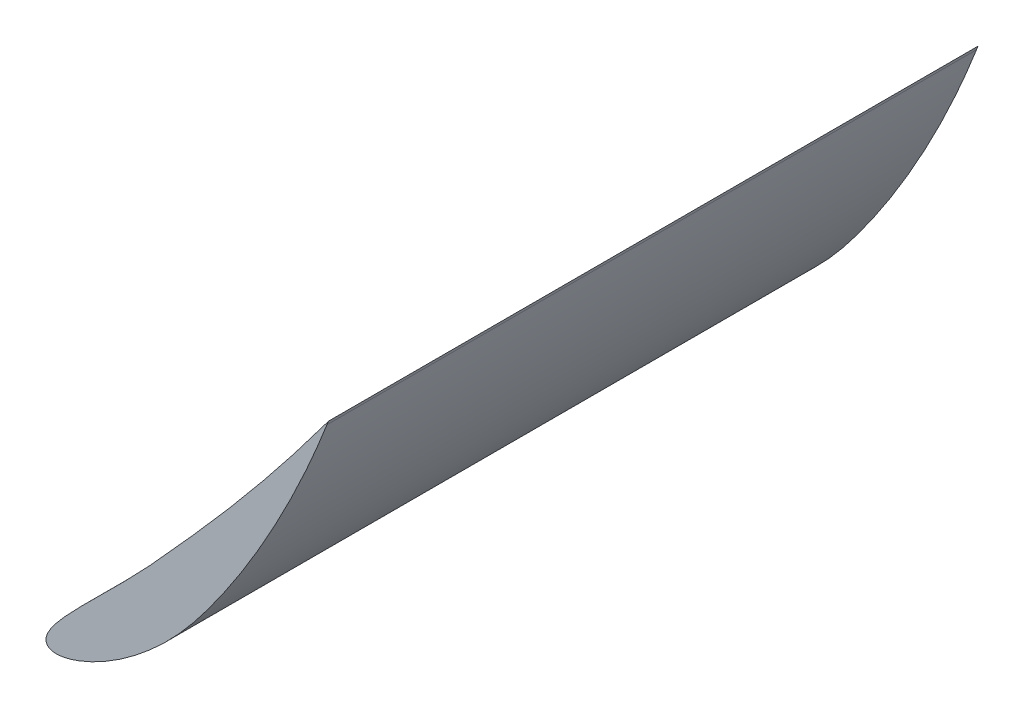
from build123d import *

# Parameters (mm, degrees)
BOSS_EXTRUDE1_DEPTH = 228.6


with BuildPart() as part:
    # Sketch1 → Boss-Extrude1 (new body)
    with BuildSketch(Plane.XY):
        with BuildLine():
            Line((97.813733214, 116.868603431), (98.631287897, 117.970297864))
            Line((98.631287897, 117.970297864), (98.107930219, 116.621742832))
            add(Edge.make_bspline(
                [(98.107930219, 116.621742832), (98.07801504, 116.544659288), (97.958558513, 116.236851248), (97.689273802, 115.547006234), (97.240037934, 114.404059771), (96.609003613, 112.818724882), (95.794855225, 110.805135637), (94.795820224, 108.38138303), (93.610319053, 105.568768694), (92.237197618, 102.391824455), (90.675809542, 98.877661272), (88.925940701, 95.056088102), (86.98938393, 90.958371877), (84.868121504, 86.617956454), (82.565559006, 82.069626079), (80.087304421, 77.348824446), (77.439505968, 72.492152356), (74.630452673, 67.536440727), (71.669301571, 62.518881178), (68.566940922, 57.476719864), (65.336524815, 52.4460022), (61.991116763, 47.463414346), (58.547239856, 42.563147076), (55.018907809, 37.781638104), (51.436484036, 33.141179764), (47.734989115, 28.738803302), (43.94718041, 24.598051047), (40.101909176, 20.739713361), (36.231846694, 17.180383406), (32.372054377, 13.932580409), (28.55919633, 11.005685778), (24.831811775, 8.404852292), (21.228534655, 6.132931801), (17.78843142, 4.189190577), (14.549557874, 2.570815951), (11.547836298, 1.27357543), (8.816936286, 0.290663381), (6.385798662, -0.384068928), (4.278148337, -0.759421479), (2.507945652, -0.841091713), (1.075856946, -0.630099094), (-0.016081371, -0.098164963), (-0.694809938, 0.792786704), (-0.826333116, 1.958474324), (-0.495963942, 3.291459945), (0.236182589, 4.834249535), (1.365544939, 6.603747658), (2.880735226, 8.604450584), (4.766161485, 10.834891684), (7.000774329, 13.291518365), (9.559743009, 15.96973743), (12.41365281, 18.865099168), (15.53128733, 21.971532577), (18.877704366, 25.283416008), (22.416727847, 28.79351034), (26.110153606, 32.494080901), (29.919561066, 36.375547799), (33.805981413, 40.426973128), (37.732446576, 44.634743282), (41.658159817, 48.987486858), (45.632259151, 53.393089395), (49.613105115, 57.841187968), (53.574221912, 62.305859138), (57.485854698, 66.764142947), (61.321955514, 71.190023639), (65.057320193, 75.557697094), (68.668804722, 79.840130915), (72.135956402, 84.009508776), (75.439083539, 88.038628097), (78.561652728, 91.899450431), (81.487941908, 95.565167313), (84.204374052, 99.009452971), (86.698170757, 102.207726841), (88.959042546, 105.136108909), (90.976778641, 107.773302857), (92.7432067, 110.09961291), (94.250420258, 112.098040239), (95.492454297, 113.753595868), (96.46399614, 115.054026865), (97.160788813, 115.989952744), (97.580313003, 116.554058419), (97.766999218, 116.805627114), (97.813733214, 116.868603431)],
                knots=[0, 0, 0, 0, 0.000791305, 0.003159821, 0.007087067, 0.012544017, 0.019489361, 0.027872822, 0.037632601, 0.048699423, 0.060994432, 0.074433103, 0.088923206, 0.104367786, 0.120665388, 0.137709591, 0.15539151, 0.173600813, 0.192223028, 0.211145779, 0.230254002, 0.249435263, 0.268576885, 0.287568118, 0.306301322, 0.324670996, 0.34259499, 0.35999234, 0.376785861, 0.392898379, 0.408252229, 0.422771246, 0.436380025, 0.44900307, 0.460569968, 0.471014387, 0.480280085, 0.488325188, 0.49513273, 0.500728157, 0.50521737, 0.508862648, 0.512070109, 0.515470595, 0.519696371, 0.525078124, 0.531750336, 0.539754064, 0.549080127, 0.559691732, 0.571531153, 0.584527708, 0.598597801, 0.613649926, 0.62958577, 0.646300272, 0.663685555, 0.681632124, 0.700026867, 0.718761006, 0.737726751, 0.75680858, 0.775887894, 0.794846492, 0.813569043, 0.831939507, 0.849846884, 0.867180215, 0.883834326, 0.899707217, 0.914700572, 0.928722615, 0.941687172, 0.953513138, 0.964128061, 0.973465194, 0.981467029, 0.988082829, 0.993272151, 0.997001957, 0.999249486, 1, 1, 1, 1], degree=3))
        make_face()
    extrude(amount=BOSS_EXTRUDE1_DEPTH)


solid = part.part
